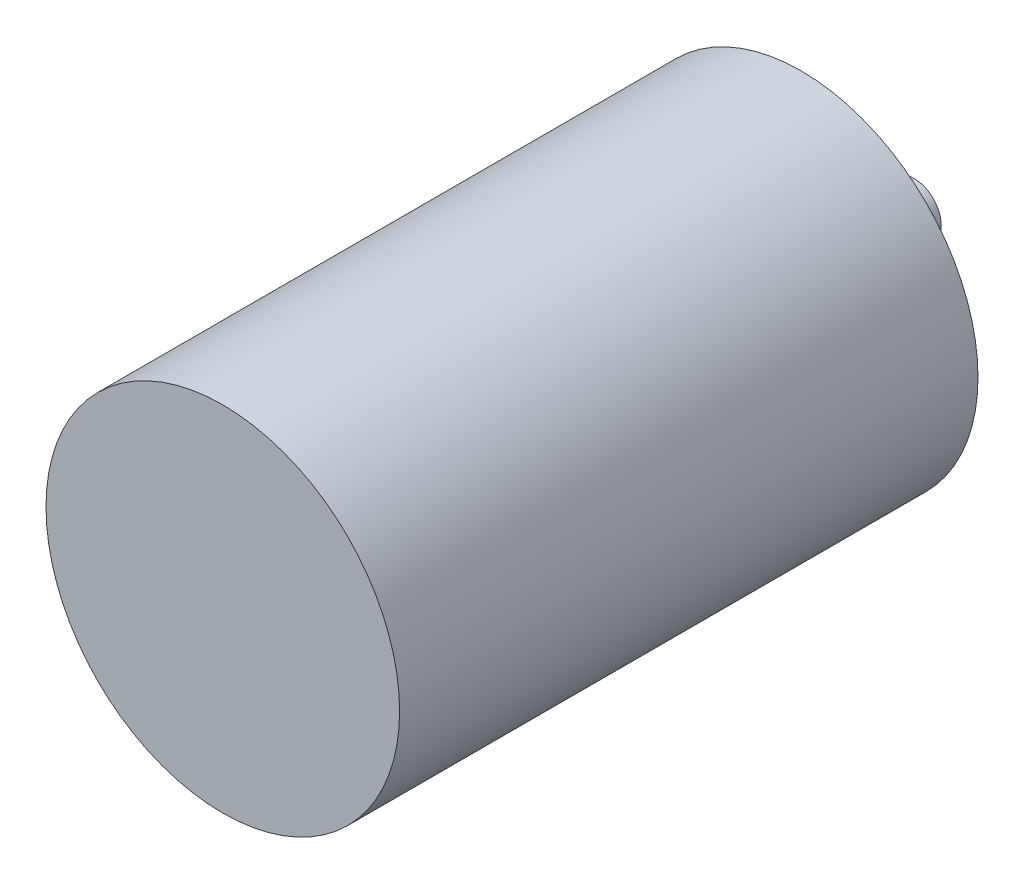
from build123d import *

# Parameters (mm, degrees)
ESBO_O1_R                       = 39.125
RESSALTO_EXTRUS_O1_DEPTH        = 128
FURO_ROSCADO_DE_M51_D           = 4.2
FURO_ROSCADO_DE_M51_DEPTH       = 10
FURO_ROSCADO_DE_M51_CSINK_D     = 5.05
FURO_ROSCADO_DE_M51_CSINK_ANGLE = 90
FURO_ROSCADO_DE_M51_TIP         = 1.2618073
ESBO_O1_4_R                     = 6
RESSALTO_EXTRUS_O2_DEPTH        = 25


with BuildPart() as part:
    # Esboço1 → Ressalto-extrusão1 (new body)
    with BuildSketch(Plane.XY):
        Circle(ESBO_O1_R)
    extrude(amount=RESSALTO_EXTRUS_O1_DEPTH)

    # Furo roscado de M51
    with Locations(Plane(origin=(0, 0, 0), x_dir=(-1, 0, 0), z_dir=(0, 0, -1))):
        with Locations((0, 26), (-26, 0), (0, -26), (26, 0)):
            CounterSinkHole(FURO_ROSCADO_DE_M51_D / 2, FURO_ROSCADO_DE_M51_CSINK_D / 2, depth=FURO_ROSCADO_DE_M51_DEPTH, counter_sink_angle=FURO_ROSCADO_DE_M51_CSINK_ANGLE)
            with Locations((0, 0, -(FURO_ROSCADO_DE_M51_DEPTH + FURO_ROSCADO_DE_M51_TIP / 2))):  # 118° drill point
                Cone(0, FURO_ROSCADO_DE_M51_D / 2, FURO_ROSCADO_DE_M51_TIP, mode=Mode.SUBTRACT)

    # Esboço1<4> → Ressalto-extrusão2 (add)
    with BuildSketch(Plane.XY):
        Circle(ESBO_O1_4_R)
    extrude(amount=-RESSALTO_EXTRUS_O2_DEPTH)


solid = part.part
